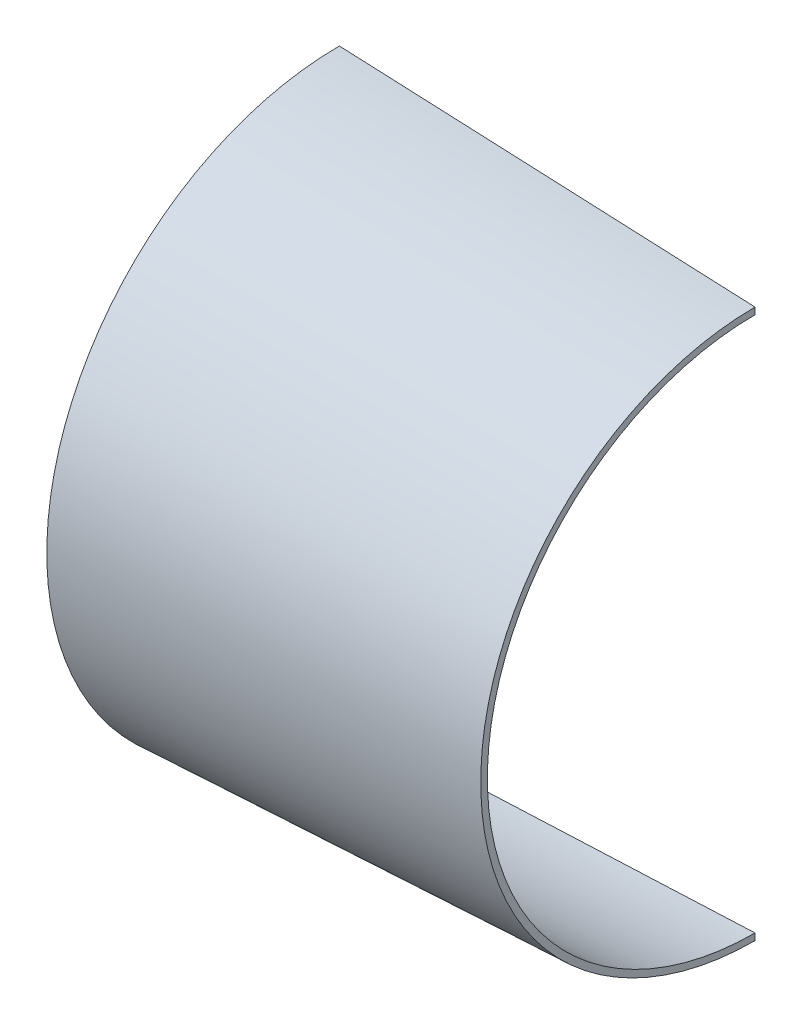
from build123d import *

# Parameters (mm, degrees)
REVOLVE1_ANGLE = 179.99999693


with BuildPart() as part:
    # Sketch1 → Revolve1 (revolve)
    with BuildSketch(Plane.XY):
        Polygon((700, 1720), (700, 1760), (3200, 1650), (3200, 1610), align=None)
    revolve(axis=Axis((0, 0, 0), (1, 0, 0)), revolution_arc=REVOLVE1_ANGLE)


solid = part.part
